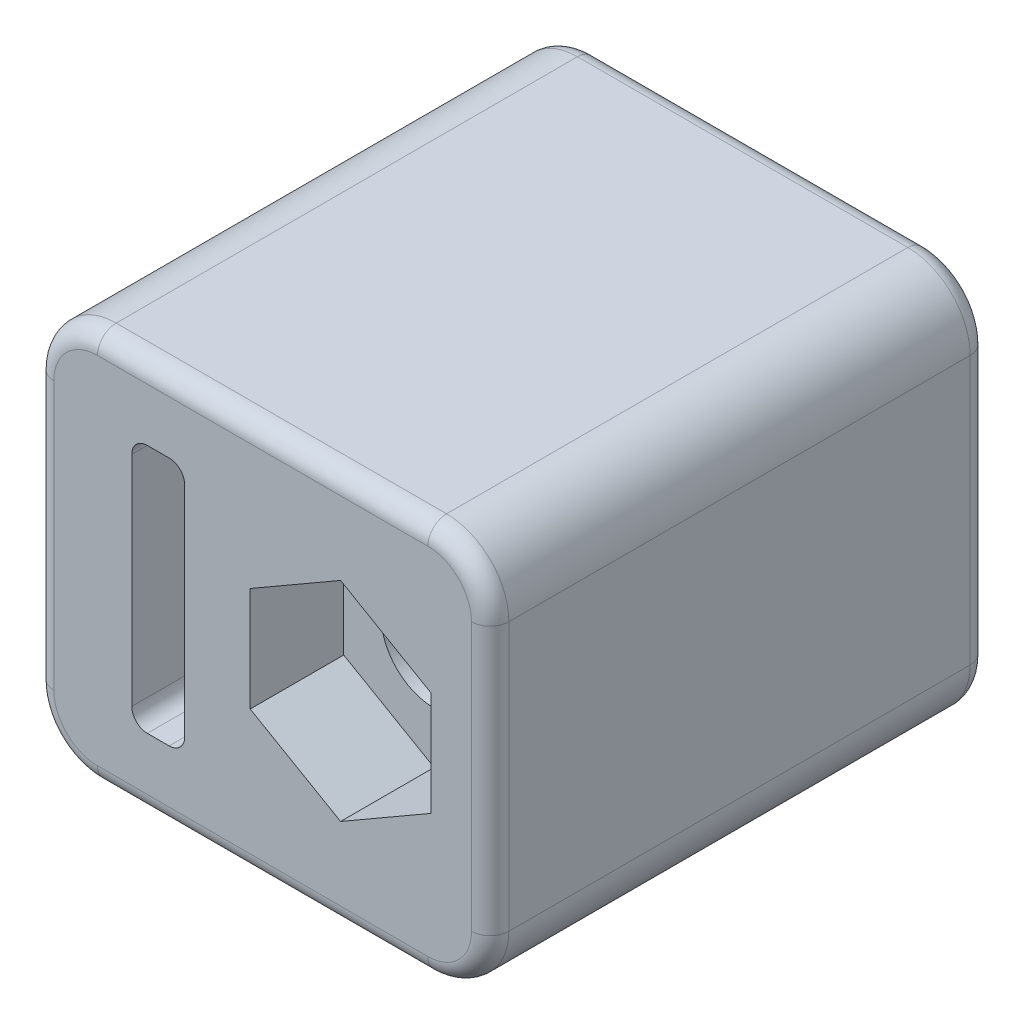
from build123d import *

# Parameters (mm, degrees)
SKETCH1_R           = 1.7
BOSS_EXTRUDE1_DEPTH = 16
CUT_EXTRUDE1_DEPTH  = 3
CUT_EXTRUDE2_DEPTH  = 8
FILLET1_R           = 0.6


with BuildPart() as part:
    # Sketch1 → Boss-Extrude1 (new body)
    with BuildSketch(Plane.XY):
        with BuildLine():
            Line((2, 0), (12.6, 0))
            ThreePointArc((12.6, 0), (14.014213562, 0.585786438), (14.6, 2))
            Line((14.6, 2), (14.6, 10.6))
            ThreePointArc((14.6, 10.6), (14.014213562, 12.014213562), (12.6, 12.6))
            Line((12.6, 12.6), (2, 12.6))
            ThreePointArc((2, 12.6), (0.585786438, 12.014213562), (0, 10.6))
            Line((0, 10.6), (0, 2))
            ThreePointArc((0, 2), (0.585786438, 0.585786438), (2, 0))
        make_face()
        with Locations((9.8, 6.3)):
            Circle(SKETCH1_R, mode=Mode.SUBTRACT)
        with BuildLine():
            Line((3.1, 9.8), (3.1, 2.8))
            ThreePointArc((3.1, 2.8), (3.246446609, 2.446446609), (3.6, 2.3))
            Line((3.6, 2.3), (4.3, 2.3))
            ThreePointArc((4.3, 2.3), (4.653553391, 2.446446609), (4.8, 2.8))
            Line((4.8, 2.8), (4.8, 9.8))
            ThreePointArc((4.8, 9.8), (4.653553391, 10.153553391), (4.3, 10.3))
            Line((4.3, 10.3), (3.6, 10.3))
            ThreePointArc((3.6, 10.3), (3.246446609, 10.153553391), (3.1, 9.8))
        make_face(mode=Mode.SUBTRACT)
    extrude(amount=BOSS_EXTRUDE1_DEPTH)

    # Sketch2 → Cut-Extrude1 (cut)
    with BuildSketch(Plane.XY.offset(16)):
        Polygon((9.8, 9.648631561), (6.9, 7.974315781), (6.9, 4.625684219), (9.8, 2.951368439), (12.7, 4.625684219), (12.7, 7.974315781), align=None)
    extrude(amount=-CUT_EXTRUDE1_DEPTH, mode=Mode.SUBTRACT)

    # Sketch3 → Cut-Extrude2 (cut)
    with BuildSketch(Plane(origin=(0, 0, 0), x_dir=(-1, 0, 0), z_dir=(0, 0, -1))):
        with BuildLine():
            Line((-4.8, 9.8), (-4.8, 2.8))
            ThreePointArc((-4.8, 2.8), (-4.653553391, 2.446446609), (-4.3, 2.3))
            Line((-4.3, 2.3), (-2.8, 2.3))
            ThreePointArc((-2.8, 2.3), (-2.446446609, 2.446446609), (-2.3, 2.8))
            Line((-2.3, 2.8), (-2.3, 9.8))
            ThreePointArc((-2.3, 9.8), (-2.446446609, 10.153553391), (-2.8, 10.3))
            Line((-2.8, 10.3), (-4.3, 10.3))
            ThreePointArc((-4.3, 10.3), (-4.653553391, 10.153553391), (-4.8, 9.8))
        make_face()
    extrude(amount=-CUT_EXTRUDE2_DEPTH, mode=Mode.SUBTRACT)

    # Fillet1
    fillet1_edges = [part.edges().sort_by_distance(p)[0] for p in [
        (0, 6.3, 0),
        (0.585786438, 12.014213562, 0),
        (7.3, 12.6, 0),
        (14.014213562, 12.014213562, 0),
        (0.585786438, 12.014213562, 16),
        (0, 6.3, 16),
        (0.585786438, 0.585786438, 16),
        (7.3, 0, 16),
        (14.014213562, 0.585786438, 16),
        (14.6, 6.3, 16),
        (14.014213562, 12.014213562, 16),
        (14.6, 6.3, 0),
        (7.3, 12.6, 16),
        (14.014213562, 0.585786438, 0),
        (7.3, 0, 0),
        (0.585786438, 0.585786438, 0),
    ]]
    fillet(fillet1_edges, radius=FILLET1_R)


solid = part.part
